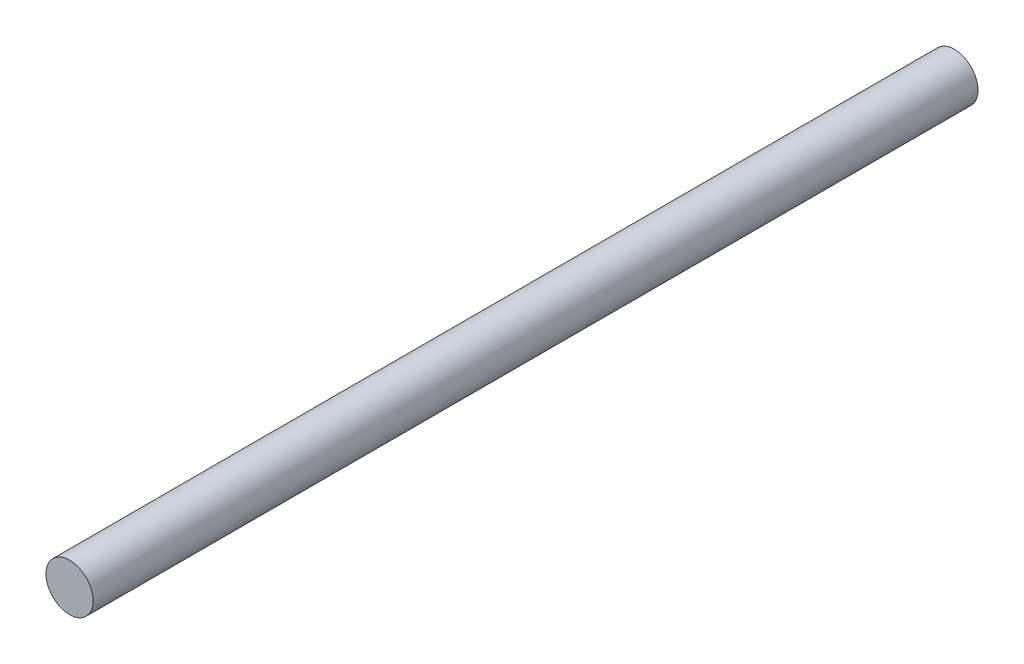
from build123d import *

# Parameters (mm, degrees)
SKETCH_1_R      = 8
EXTRUDE_1_DEPTH = 300


with BuildPart() as part:
    # 草图1 → 凸台-拉伸1 (new body)
    with BuildSketch(Plane.XY):
        Circle(SKETCH_1_R)
    extrude(amount=EXTRUDE_1_DEPTH)


solid = part.part
